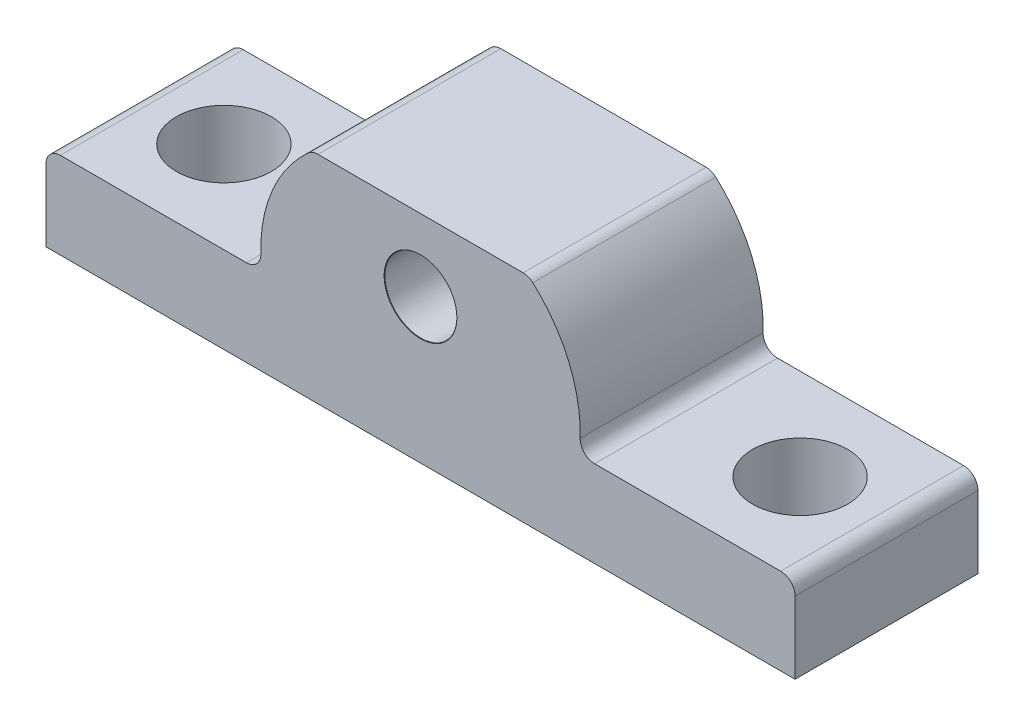
from build123d import *

# Parameters (mm, degrees)
BOSS_EXTRUDE1_DEPTH                   = 12.7
TAP_DRILL_FOR_M6X1_0_TAP1_D           = 5
TAP_DRILL_FOR_M6X1_0_TAP1_CSINK_D     = 5.05
TAP_DRILL_FOR_M6X1_0_TAP1_CSINK_ANGLE = 90
M6_CLEARANCE_HOLE1_D                  = 6.6
M6_CLEARANCE_HOLE1_CSINK_D            = 6.65
M6_CLEARANCE_HOLE1_CSINK_ANGLE        = 90
FILLET1_R                             = 1


with BuildPart() as part:
    # Sketch1 → Boss-Extrude1 (new body)
    with BuildSketch(Plane.XY):
        with BuildLine():
            Line((-26, 0), (26, 0))
            Line((26, 0), (26, 6))
            Line((26, 6), (11, 6))
            ThreePointArc((11, 6), (10.408351378, 10.95046998), (7.5, 15))
            Line((7.5, 15), (-7.5, 15))
            ThreePointArc((-7.5, 15), (-10.408351378, 10.95046998), (-11, 6))
            Line((-11, 6), (-26, 6))
            Line((-26, 6), (-26, 0))
        make_face()
    extrude(amount=-BOSS_EXTRUDE1_DEPTH)

    # Tap Drill for M6x1.0 Tap1 (through all)
    with Locations(Plane(origin=(0, 10, 0), x_dir=(1, 0, 0), z_dir=(0, 0, 1))):
        with Locations((0, 0)):
            CounterSinkHole(TAP_DRILL_FOR_M6X1_0_TAP1_D / 2, TAP_DRILL_FOR_M6X1_0_TAP1_CSINK_D / 2, counter_sink_angle=TAP_DRILL_FOR_M6X1_0_TAP1_CSINK_ANGLE)

    # M6 Clearance Hole1 (through all)
    with Locations(Plane(origin=(-20, 0, -6.35), x_dir=(-1, 0, 0), z_dir=(0, -1, 0))):
        with Locations((0, 0), (-40, 0)):
            CounterSinkHole(M6_CLEARANCE_HOLE1_D / 2, M6_CLEARANCE_HOLE1_CSINK_D / 2, counter_sink_angle=M6_CLEARANCE_HOLE1_CSINK_ANGLE)

    # Fillet1
    fillet1_edges = [part.edges().sort_by_distance(p)[0] for p in [
        (-26, 6, -6.35),
        (26, 6, -6.35),
        (11, 6, -6.35),
        (7.5, 15, -6.35),
        (-7.5, 15, -6.35),
        (-11, 6, -6.35),
    ]]
    fillet(fillet1_edges, radius=FILLET1_R)


solid = part.part
